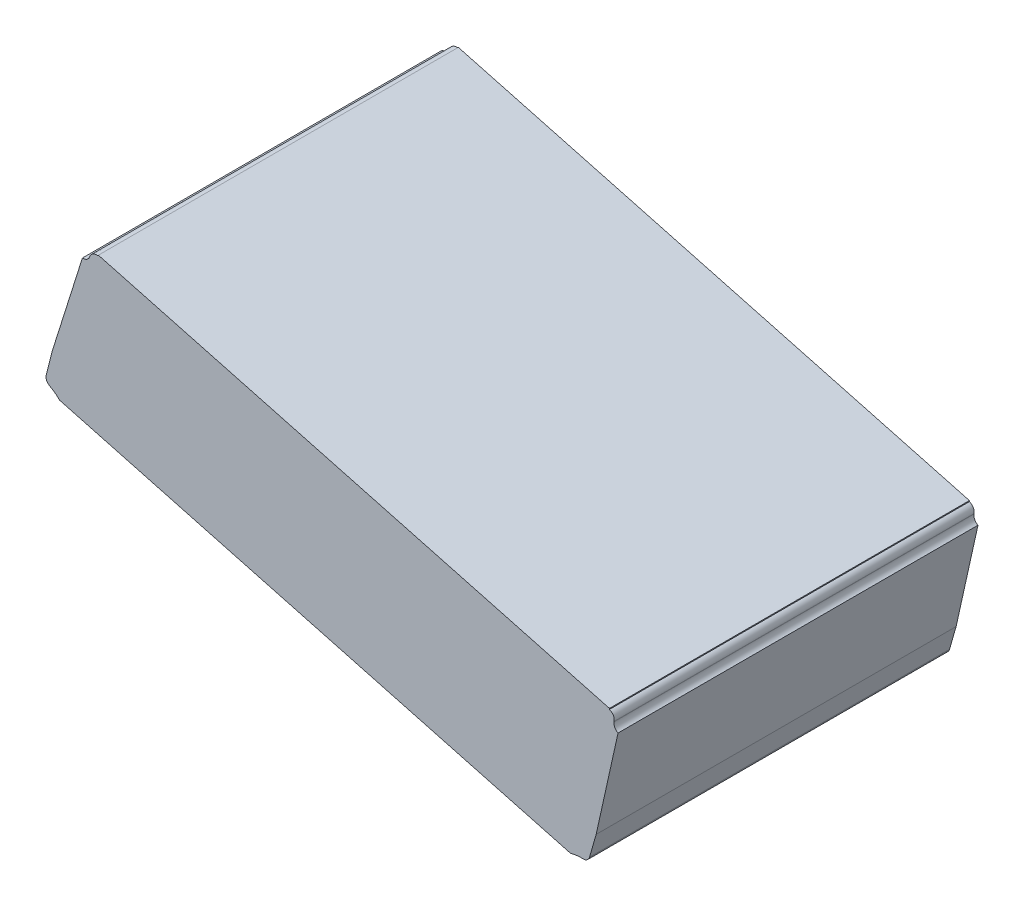
from build123d import *

# Parameters (mm, degrees)
BOSS_EXTRUDE1_DEPTH = 100


with BuildPart() as part:
    # Sketch1 → Boss-Extrude1 (new body)
    with BuildSketch(Plane(origin=(0, 0, 0), x_dir=(-1, 0, 0), z_dir=(0, 0, 1))):
        with BuildLine():
            Line((67.973290008, -37.656184374), (68.004301332, -37.570981461))
            ThreePointArc((68.004301332, -37.570981461), (68.797575177, -36.575628395), (70.030727156, -36.260434305))
            Line((70.030727156, -36.260434305), (78.47997961, -9.462829137))
            Line((78.47997961, -9.462829137), (80.091350343, -2.999974125))
            ThreePointArc((80.091350343, -2.999974125), (79.982164163, -1.81678638), (79.159491845, -0.959426994))
            ThreePointArc((79.159491845, -0.959426994), (77.685261787, -0.04212625), (76.391925323, 1.116353663))
            Line((76.391925323, 1.116353663), (-65.599171142, 39.162753293))
            ThreePointArc((-65.599171142, 39.162753293), (-67.298473332, 38.806148491), (-69.033844385, 38.748857773))
            ThreePointArc((-69.033844385, 38.748857773), (-70.174979205, 38.417698923), (-70.861131083, 37.447621369))
            Line((-70.861131083, 37.447621369), (-72.6970706, 31.044939381))
            Line((-72.6970706, 31.044939381), (-78.778605915, 3.612906317))
            ThreePointArc((-78.778605915, 3.612906317), (-77.86826202, 2.723364239), (-77.678943251, 1.464726275))
            Line((-77.678943251, 1.464726275), (-77.694688113, 1.375432727))
            ThreePointArc((-77.694688113, 1.375432727), (-77.453437445, 0.021779086), (-76.395283749, -0.8562248))
            ThreePointArc((-76.395283749, -0.8562248), (-76.393715257, -0.986290661), (-76.391925323, -1.116353663))
            Line((-76.391925323, -1.116353663), (65.599171142, -39.162753293))
            ThreePointArc((65.599171142, -39.162753293), (65.665752771, -39.051010396), (65.732144056, -38.939154303))
            ThreePointArc((65.732144056, -38.939154303), (67.08753398, -38.707857481), (67.973290008, -37.656184374))
        make_face()
    extrude(amount=BOSS_EXTRUDE1_DEPTH)


solid = part.part
